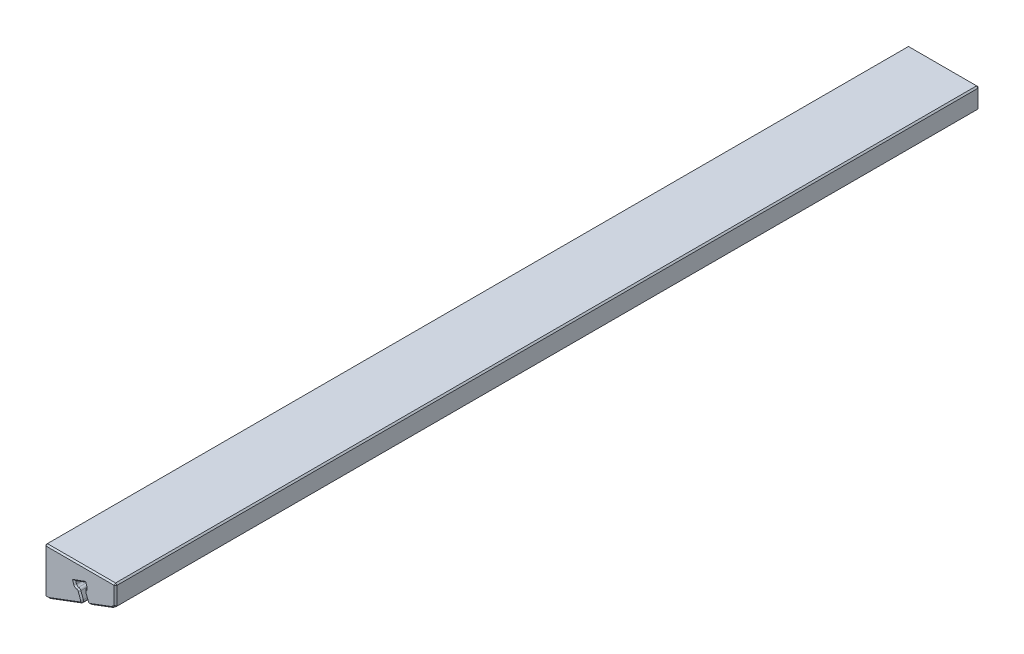
from build123d import *

# Parameters (mm, degrees)
BOSS_EXTRUDE1_DEPTH            = 300
CBORE_FOR_M3_SBHCS1_AT_2_COUNT = 2
CBORE_FOR_M3_SBHCS1_AT_2_PITCH = 124.99999999999997
CBORE_FOR_M3_SBHCS1_AT_3_COUNT = 2
CBORE_FOR_M3_SBHCS1_AT_3_PITCH = 249.99999999999997
BOSS_EXTRUDE2_DEPTH            = 5
FILLET1_R                      = 1
LPATTERN1_COUNT                = 2
LPATTERN1_PITCH                = 305
CHAMFER2_SIZE                  = 0.5
FILLET2_R                      = 1


with BuildPart() as part:
    # Sketch1 → Boss-Extrude1 (new body)
    with BuildSketch(Plane.XY):
        Polygon((20, 20), (20, 3.5), (21.600000000000005, 3.5), (24.999999999999996, 7.527677706789349), (25.000000000000004, 11.52767770678935), (40.03508193257454, 17), (44.2305800884609, 12), (45.45625119745129, 13.028460175498461), (45.456251197451294, 20), align=None)
    extrude(amount=BOSS_EXTRUDE1_DEPTH)

    # Sketch4 → CBORE for M3 SBHCS1 (revolve, cut)
    with BuildSketch(Plane(origin=(25, 7.527677706789349, 274.99999999999994), x_dir=(0, 0, -1), z_dir=(2.31e-15, 1, 0))):
        Polygon((0, 0), (-1.22e-15, 5.000000000000024), (1.7999999999999992, 5.000000000000024), (1.8000000000000005, 1.6499999999999997), (3.3499999999999956, 1.6499999999999952), (3.350000000000001, 0.02499999999999889), (3.3749999999999996, -3.47e-15), align=None)
    cbore_for_m3_sbhcs1 = revolve(axis=Axis((31.34999999999999, 7.527677706789334, 274.99999999999994), (-1, 2.32e-15, 0)), mode=Mode.SUBTRACT)

    # CBORE for M3 SBHCS1 at 2: CBORE for M3 SBHCS1 ×2
    with Locations(*[(0, 0, -i * CBORE_FOR_M3_SBHCS1_AT_2_PITCH) for i in range(1, CBORE_FOR_M3_SBHCS1_AT_2_COUNT)]):
        add(cbore_for_m3_sbhcs1, mode=Mode.SUBTRACT)

    # CBORE for M3 SBHCS1 at 3: CBORE for M3 SBHCS1 ×2
    with Locations(*[(0, 0, -i * CBORE_FOR_M3_SBHCS1_AT_3_PITCH) for i in range(1, CBORE_FOR_M3_SBHCS1_AT_3_COUNT)]):
        add(cbore_for_m3_sbhcs1, mode=Mode.SUBTRACT)

    # Sketch5 → Boss-Extrude2 (add)
    with BuildSketch(Plane.XY.offset(300)):
        with BuildLine():
            Line((24.999999999999996, 7.527677706789349), (21.600000000000005, 3.5))
            Line((21.600000000000005, 3.5), (33.71474845278774, 8.05027495743257))
            Line((33.71474845278774, 8.050274957432569), (33.70794748463962, 8.069572384153874))
            Line((33.70794748463962, 8.069572384153874), (32.53600076787437, 11.394915981634217))
            ThreePointArc((32.53600076787437, 11.394915981634217), (32.24344854430553, 11.821955076935874), (31.77657133911045, 12.045505670091789))
            Line((31.77657133911045, 12.045505670091789), (31.704265005172275, 12.059019247038602))
            ThreePointArc((31.704265005172275, 12.0590192470386), (31.23738779997721, 12.282569840194535), (30.94483557640838, 12.70960893549619))
            Line((30.94483557640838, 12.70960893549619), (30.638155724715453, 13.57979856674334))
            Line((30.638155724715453, 13.579798566743342), (25.000000000000004, 11.52767770678935))
            Line((25.000000000000004, 11.52767770678935), (24.999999999999996, 7.527677706789349))
        make_face()
        with BuildLine():
            Line((34.34750801297435, 12.054250698008177), (35.587234405375604, 8.753576884947558))
            Line((35.587234405375604, 8.753576884947558), (44.2305800884609, 12))
            Line((44.2305800884609, 12), (40.03508193257454, 17))
            Line((40.03508193257454, 17), (34.396926207859096, 14.947879140046009))
            Line((34.396926207859096, 14.947879140046007), (34.721342924696536, 14.084145199760654))
            ThreePointArc((34.721342924696536, 14.084145199760654), (34.77173035882119, 13.568965329313977), (34.5577772215813, 13.097612756926463))
            Line((34.5577772215813, 13.097612756926463), (34.511073716089605, 13.04078314084238))
            ThreePointArc((34.511073716089605, 13.04078314084238), (34.297120578849714, 12.569430568454859), (34.34750801297435, 12.054250698008177))
        make_face()
        Polygon((20, 3.5), (21.600000000000005, 3.5), (24.999999999999996, 7.527677706789349), (25.000000000000004, 11.52767770678935), (30.638155724715453, 13.579798566743342), (34.396926207859096, 14.947879140046007), (40.03508193257454, 17), (44.2305800884609, 12), (45.45625119745129, 13.028460175498461), (45.456251197451294, 20), (20, 20), align=None)
    boss_extrude2 = extrude(amount=BOSS_EXTRUDE2_DEPTH)

    # Fillet1
    fillet1_edges = [part.edges().sort_by_distance(p)[0] for p in [
        (35.587234405375604, 8.753576884947558, 302.5),
        (33.71474845278774, 8.05027495743257, 302.5),
    ]]
    fillet(fillet1_edges, radius=FILLET1_R)

    # LPattern1: Boss-Extrude2 ×2
    with Locations(*[(0, 0, -i * LPATTERN1_PITCH) for i in range(1, LPATTERN1_COUNT)]):
        add(boss_extrude2)

    # Chamfer2
    chamfer2_edges = [part.edges().sort_by_distance(p)[0] for p in [
        (33.35225539318084, 8.219308247155407, 300),
        (40.37697975127303, 10.552595526139491, 305),
        (35.758439525002586, 9.13075281507476, 305),
        (33.35225539318084, 8.219308247155407, 305),
        (40.37697975127303, 10.552595526139491, 300),
        (35.758439525002586, 9.13075281507476, 300),
        (34.55913456627782, 14.51601216990333, 0),
        (34.53442546883545, 13.069197948884423, 0),
        (34.96737120917498, 10.403913791477867, 0),
        (39.90890724691825, 10.376788442473778, 0),
        (27.65737422639387, 5.775137478716285, 0),
        (32.24344854430553, 11.821955076935874, 0),
        (31.74041817214136, 12.052262458565195, 0),
        (31.23738779997721, 12.282569840194535, 0),
        (30.791495650561917, 13.144703751119765, 0),
        (32.51754096628727, 14.263838853394676, -5),
        (34.55913456627782, 14.51601216990333, -5),
        (34.77173035882119, 13.56896532931398, 0),
        (34.53442546883545, 13.069197948884423, -5),
        (34.297120578849714, 12.569430568454859, 0),
        (34.96737120917498, 10.403913791477867, -5),
        (39.90890724691825, 10.376788442473778, -5),
        (44.84341564295609, 12.51423008774923, -5),
        (45.45625119745129, 16.51423008774923, -5),
        (32.72812559872565, 20, -5),
        (20, 11.75, -5),
        (20.800000000000004, 3.5, -5),
        (27.65737422639387, 5.775137478716285, -5),
        (33.12537461033105, 9.722595469533394, 0),
        (32.24344854430553, 11.821955076935874, -5),
        (31.74041817214136, 12.052262458565195, -5),
        (31.23738779997721, 12.282569840194535, -5),
        (30.791495650561917, 13.144703751119765, -5),
        (33.12537461033105, 9.722595469533394, -5),
        (34.297120578849714, 12.569430568454859, -5),
        (34.77173035882119, 13.56896532931398, -5),
        (45.456251197451294, 20, 150),
        (20, 3.5, 150),
        (20, 20, 150),
        (30.791495650561917, 13.144703751119765, 300),
        (32.9625451430224, 10.184616411996103, 300),
        (34.297120578849714, 12.569430568454859, 300),
        (34.77173035882119, 13.56896532931398, 300),
        (30.791495650561917, 13.144703751119765, 305),
        (34.55913456627782, 14.51601216990333, 300),
        (34.77173035882119, 13.56896532931398, 305),
        (34.53442546883545, 13.069197948884423, 300),
        (34.297120578849714, 12.569430568454859, 305),
        (34.79156412550927, 10.871986295832649, 300),
        (27.19878088673786, 5.602890750093377, 300),
        (32.9625451430224, 10.184616411996103, 305),
        (32.24344854430553, 11.821955076935874, 300),
        (31.74041817214136, 12.052262458565195, 300),
        (31.23738779997721, 12.282569840194535, 300),
        (32.51754096628727, 14.263838853394676, 305),
        (34.55913456627782, 14.51601216990333, 305),
        (34.53442546883545, 13.069197948884423, 305),
        (34.79156412550927, 10.871986295832649, 305),
        (44.84341564295609, 12.51423008774923, 305),
        (45.45625119745129, 16.51423008774923, 305),
        (32.72812559872565, 20, 305),
        (20, 11.75, 305),
        (20.800000000000004, 3.5, 305),
        (27.19878088673786, 5.602890750093377, 305),
        (32.24344854430553, 11.821955076935874, 305),
        (31.74041817214136, 12.052262458565195, 305),
        (31.23738779997721, 12.282569840194535, 305),
    ]]
    chamfer(chamfer2_edges, length=CHAMFER2_SIZE)

    # Fillet2
    fillet2_edges = [part.edges().sort_by_distance(p)[0] for p in [
        (35.587234405375604, 8.753576884947558, -2.5),
        (33.71474845278774, 8.05027495743257, -2.5),
    ]]
    fillet(fillet2_edges, radius=FILLET2_R)


solid = part.part
